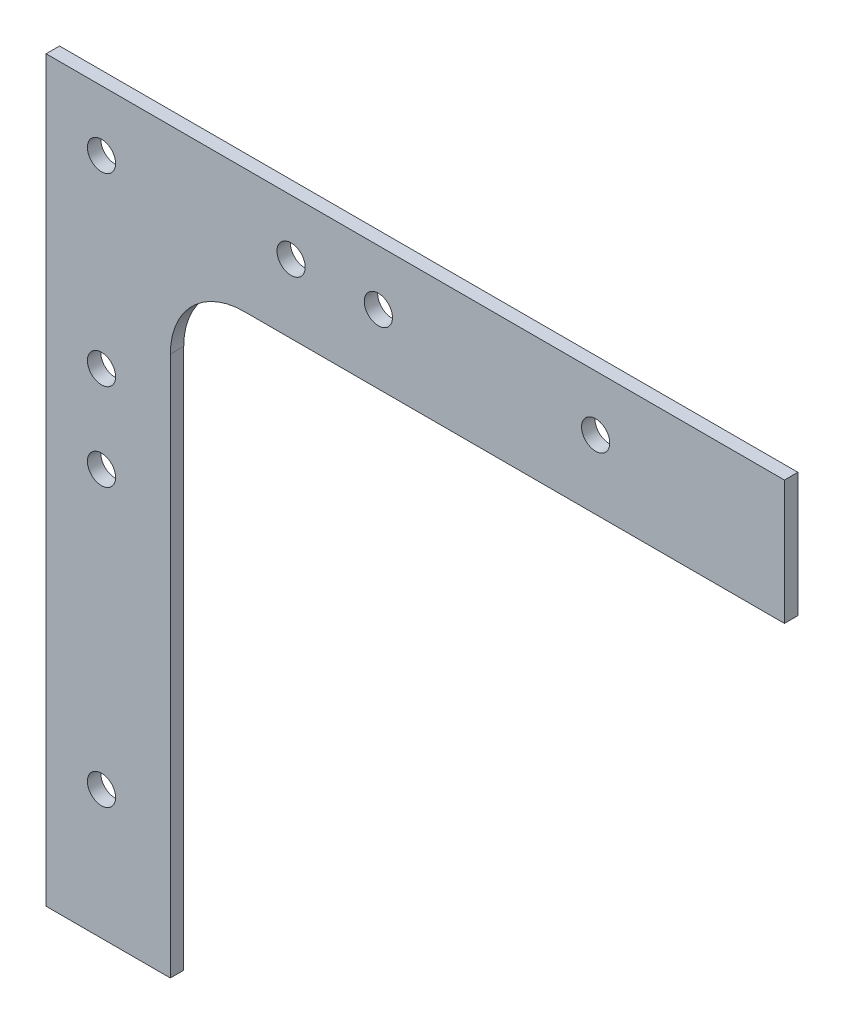
from build123d import *

# Parameters (mm, degrees)
BOSS_EXTRUDE1_DEPTH = 2.3114
FILLET1_R           = 12.7
SKETCH2_R           = 2.4257
CUT_EXTRUDE1_DEPTH  = 180.619994906
SKETCH3_R           = 2.4257
CUT_EXTRUDE2_DEPTH  = 180.619994906
SKETCH4_R           = 2.4257
CUT_EXTRUDE3_DEPTH  = 180.619994906
SKETCH5_R           = 2.4257
CUT_EXTRUDE4_DEPTH  = 180.619994906
SKETCH6_R           = 2.4257
CUT_EXTRUDE5_DEPTH  = 180.619994906


with BuildPart() as part:
    # Sketch1 → Boss-Extrude1 (new body)
    with BuildSketch(Plane.XY):
        Polygon((0, 0), (0, -127), (21.3614, -127), (21.3614, -21.3614), (127, -21.3614), (127, 0), align=None)
    extrude(amount=BOSS_EXTRUDE1_DEPTH)

    # Fillet1
    fillet1_edges = [part.edges().sort_by_distance(p)[0] for p in [
        (21.3614, -21.3614, 1.1557),
    ]]
    fillet(fillet1_edges, radius=FILLET1_R)

    # Sketch2 → Cut-Extrude1 (cut, through all)
    with BuildSketch(Plane.XY.offset(2.3114)):
        with Locations((9.525, -104.83088)):
            Circle(SKETCH2_R)
        with Locations((94.5261, -9.525)):
            Circle(SKETCH2_R)
    extrude(amount=-CUT_EXTRUDE1_DEPTH, mode=Mode.SUBTRACT)

    # Sketch3 → Cut-Extrude2 (cut, through all)
    with BuildSketch(Plane.XY.offset(2.3114)):
        with Locations((42.1386, -9.525)):
            Circle(SKETCH3_R)
        with Locations((9.525, -10.3886)):
            Circle(SKETCH3_R)
    extrude(amount=-CUT_EXTRUDE2_DEPTH, mode=Mode.SUBTRACT)

    # Sketch4 → Cut-Extrude3 (cut, through all)
    with BuildSketch(Plane.XY.offset(2.3114)):
        with Locations((9.525, -42.1386)):
            Circle(SKETCH4_R)
    extrude(amount=-CUT_EXTRUDE3_DEPTH, mode=Mode.SUBTRACT)

    # Sketch5 → Cut-Extrude4 (cut, through all)
    with BuildSketch(Plane.XY.offset(2.3114)):
        with Locations((9.525, -57.15)):
            Circle(SKETCH5_R)
    extrude(amount=-CUT_EXTRUDE4_DEPTH, mode=Mode.SUBTRACT)

    # Sketch6 → Cut-Extrude5 (cut, through all)
    with BuildSketch(Plane.XY.offset(2.3114)):
        with Locations((57.15, -9.525)):
            Circle(SKETCH6_R)
    extrude(amount=-CUT_EXTRUDE5_DEPTH, mode=Mode.SUBTRACT)


solid = part.part
